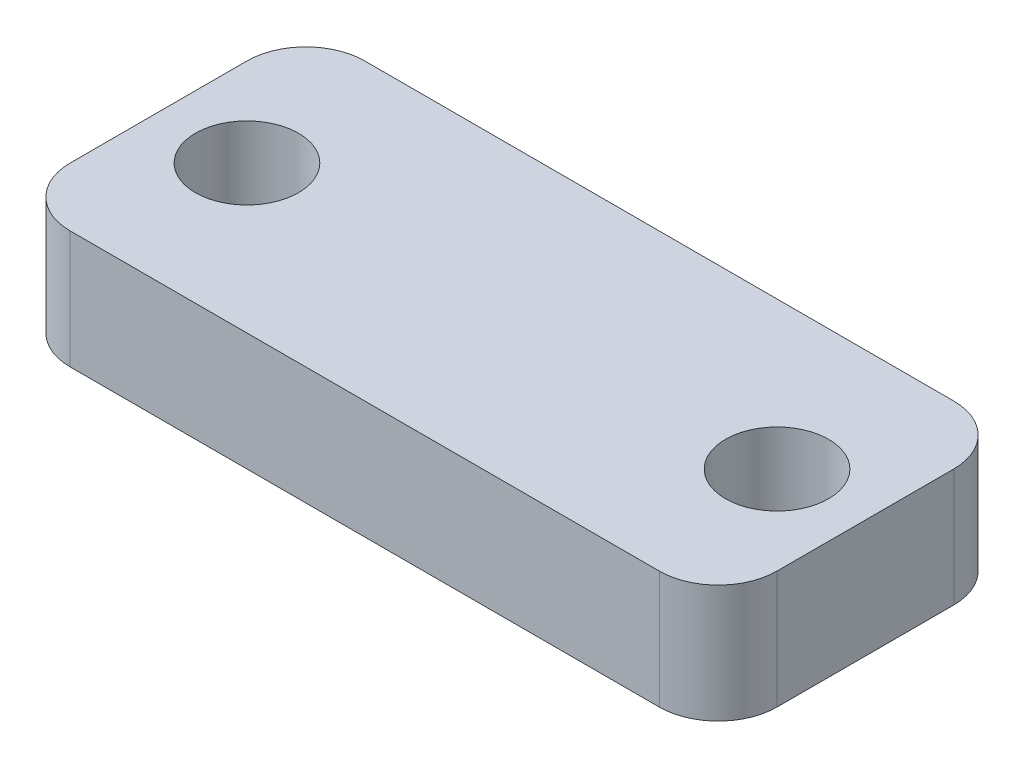
from build123d import *

# Parameters (mm, degrees)
ESBO_O1_W                = 24
ESBO_O1_H                = 10
RESSALTO_EXTRUS_O1_DEPTH = 2
ESBO_O2_R                = 1.75
CORTE_EXTRUS_O1_DEPTH    = 14.601470509
FILETE1_R                = 2


with BuildPart() as part:
    # Esboço1 → Ressalto-extrusão1 (new, symmetric)
    with BuildSketch(Plane(origin=(0, 0, 0), x_dir=(1, 0, 0), z_dir=(0, 1, 0))):
        Rectangle(ESBO_O1_W, ESBO_O1_H)
    extrude(amount=RESSALTO_EXTRUS_O1_DEPTH, both=True)

    # Esboço2 → Corte-extrusão1 (cut, through all)
    with BuildSketch(Plane(origin=(0, 2, 0), x_dir=(1, 0, 0), z_dir=(0, 1, 0))):
        with Locations(Location((-9, 0, 0), (0, 0, 270))):
            Circle(ESBO_O2_R)
    corte_extrus_o1 = extrude(amount=-CORTE_EXTRUS_O1_DEPTH, mode=Mode.SUBTRACT)

    # Espelhar1: Corte-extrusão1 across plane
    add(corte_extrus_o1.mirror(Plane(origin=(0, 0, 0), x_dir=(0, 0, 1), z_dir=(1, 0, 0))), mode=Mode.SUBTRACT)

    # Filete1
    filete1_edges = [part.edges().sort_by_distance(p)[0] for p in [
        (12, 0, 5),
        (-12, 0, 5),
        (-12, 0, -5),
        (12, 0, -5),
    ]]
    fillet(filete1_edges, radius=FILETE1_R)


solid = part.part
